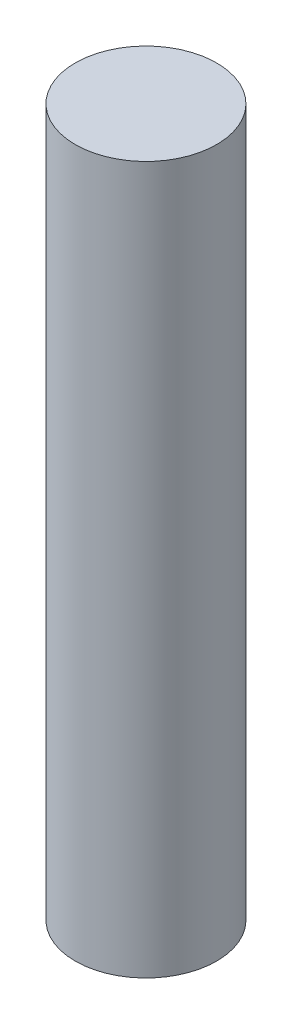
from build123d import *

# Parameters (mm, degrees)
SKETCH1_R           = 1
BOSS_EXTRUDE1_DEPTH = 10


with BuildPart() as part:
    # Sketch1 → Boss-Extrude1 (new body)
    with BuildSketch(Plane(origin=(0, 0, 0), x_dir=(1, 0, 0), z_dir=(0, 1, 0))):
        with Locations(Location((0, 0, 0), (0, 0, 270))):
            Circle(SKETCH1_R)
    extrude(amount=BOSS_EXTRUDE1_DEPTH)


solid = part.part
